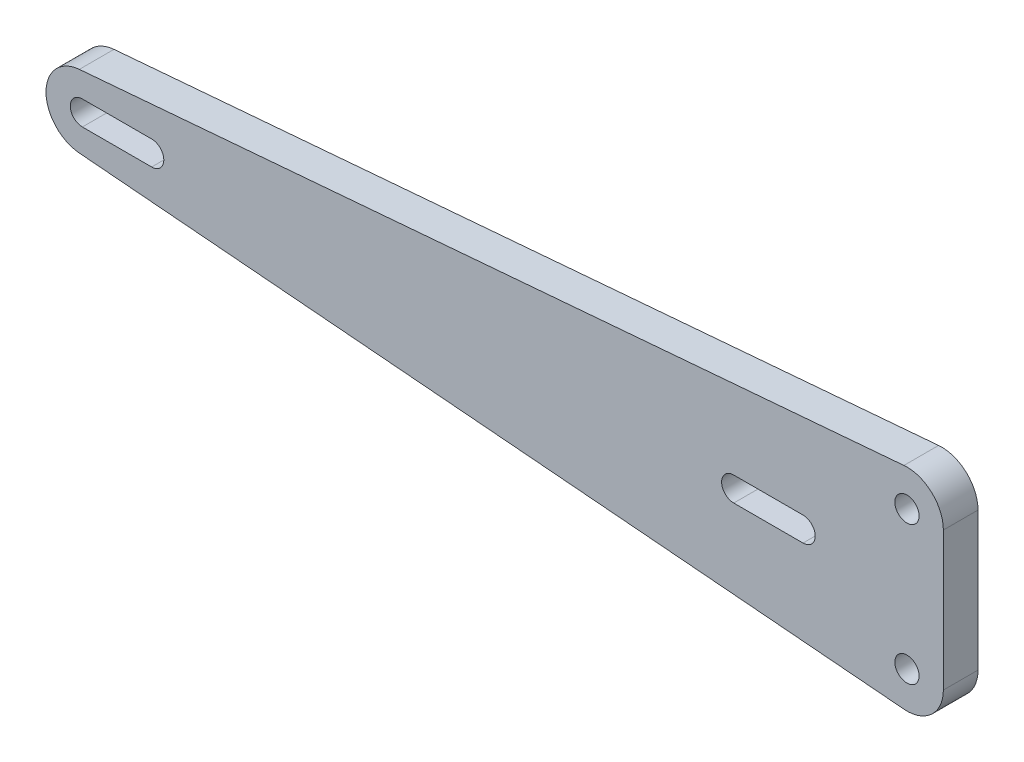
from build123d import *

# Parameters (mm, degrees)
ESBO_O1_R                = 1.75
RESSALTO_EXTRUS_O1_DEPTH = 5


with BuildPart() as part:
    # Esboço1 → Ressalto-extrusão1 (new body)
    with BuildSketch(Plane.XY):
        with BuildLine():
            Line((67.25, 10), (67.25, -10))
            ThreePointArc((67.25, -10), (65.553481285, -13.864617802), (61.560373044, -15.231560775))
            Line((61.560373044, -15.231560775), (-57.439626956, -5.231560775))
            ThreePointArc((-57.439626956, -5.231560775), (-62.25, 0), (-57.439626956, 5.231560775))
            Line((-57.439626956, 5.231560775), (61.560373044, 15.231560775))
            ThreePointArc((61.560373044, 15.231560775), (65.553481285, 13.864617802), (67.25, 10))
        make_face()
        with Locations((62, -10)):
            Circle(ESBO_O1_R, mode=Mode.SUBTRACT)
        with Locations(Location((62, 10, 0), (0, 0, 180))):
            Circle(ESBO_O1_R, mode=Mode.SUBTRACT)
        with BuildLine():
            Line((47, -1.75), (37, -1.75))
            ThreePointArc((37, -1.75), (35.25, 0), (37, 1.75))
            Line((37, 1.75), (47, 1.75))
            ThreePointArc((47, 1.75), (48.75, 0), (47, -1.75))
        make_face(mode=Mode.SUBTRACT)
        with BuildLine():
            Line((-47, -1.75), (-57, -1.75))
            ThreePointArc((-57, -1.75), (-58.75, 0), (-57, 1.75))
            Line((-57, 1.75), (-47, 1.75))
            ThreePointArc((-47, 1.75), (-45.25, 0), (-47, -1.75))
        make_face(mode=Mode.SUBTRACT)
    extrude(amount=RESSALTO_EXTRUS_O1_DEPTH)


solid = part.part
